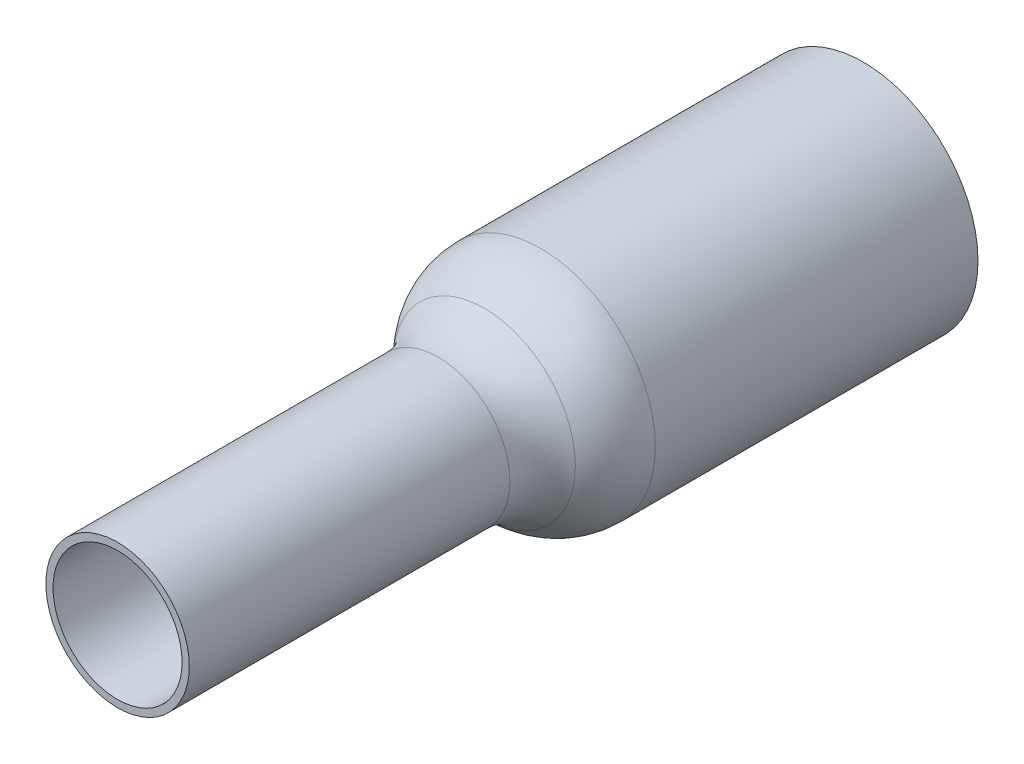
from build123d import *


with BuildPart() as part:
    # Sketch1 → Revolve-Thin1 (revolve)
    with BuildSketch(Plane(origin=(0, 0, 0), x_dir=(0, 0, -1), z_dir=(1, 0, 0)), mode=Mode.PRIVATE) as revolve_thin1_sk:
        with BuildLine():
            Line((0, 0.9), (4.471714314, 0.9))
            ThreePointArc((4.471714314, 0.9), (4.859012649, 0.978045554), (5.185857157, 1.2))
            ThreePointArc((5.185857157, 1.2), (5.512701665, 1.421954446), (5.9, 1.5))
            Line((5.9, 1.5), (10.4, 1.5))
            Line((10.4, 1.5), (10.4, 1.6))
            Line((10.4, 1.6), (5.9, 1.6))
            ThreePointArc((5.9, 1.6), (5.473971832, 1.51414989), (5.114442873, 1.27))
            ThreePointArc((5.114442873, 1.27), (4.820282815, 1.070240999), (4.471714314, 1))
            Line((4.471714314, 1), (0, 1))
            Line((0, 1), (0, 0.9))
        make_face()
    revolve(revolve_thin1_sk.sketch.rotate(Axis((0, 0, 0), (0, 0, -1)), 90), axis=Axis((0, 0, 0), (0, 0, -1)))


solid = part.part
